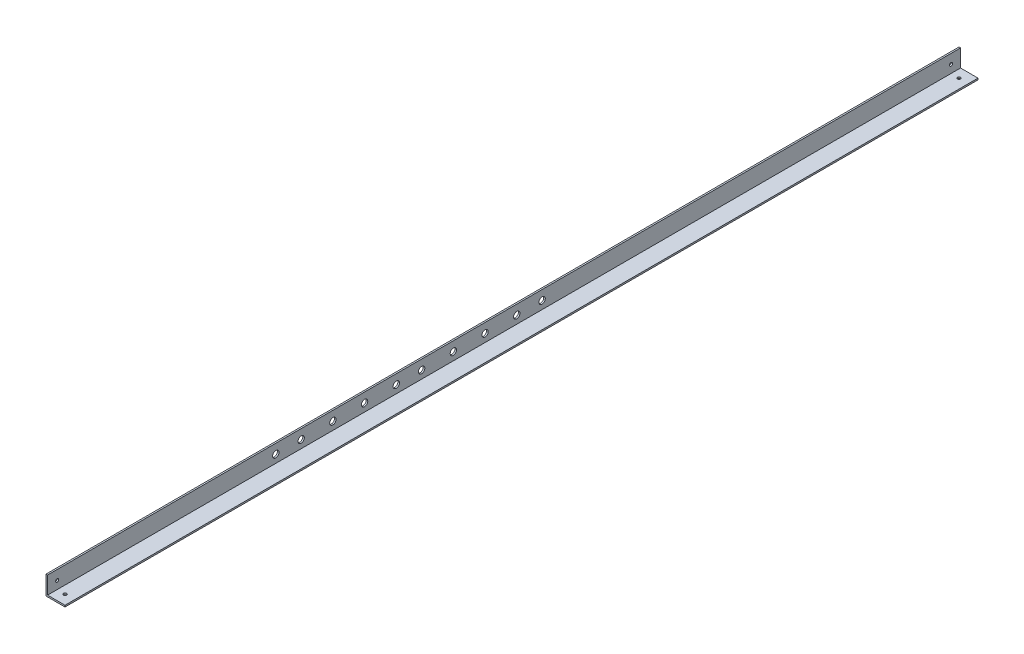
from build123d import *

# Parameters (mm, degrees)
BOSS_EXTRUDE1_DEPTH = 914.4
SKETCH2_R           = 1.5875
CUT_EXTRUDE2_DEPTH  = 2.794
SKETCH4_R           = 1.5875
SKETCH4_R_2         = 3.175
CUT_EXTRUDE3_DEPTH  = 8.89
SKETCH10_W          = 19.05
SKETCH10_H          = 914.4
CUT_EXTRUDE4_DEPTH  = 915.79678891
CUT_EXTRUDE5_REACH  = 916.797
SKETCH11_R          = 3.175


with BuildPart() as part:
    # Sketch1 → Boss-Extrude1 (new body)
    with BuildSketch(Plane.XY):
        Polygon((0, 0), (0, 19.05), (1.5875, 19.05), (1.5875, 1.5875), (19.05, 1.5875), (19.05, 0), align=None)
    boss_extrude1 = extrude(amount=-BOSS_EXTRUDE1_DEPTH)

    # Sketch2 → Cut-Extrude2 (cut)
    with BuildSketch(Plane(origin=(0, 1.5875, 0), x_dir=(1, 0, 0), z_dir=(0, 1, 0))):
        with Locations((9.525, 9.525)):
            Circle(SKETCH2_R)
        with Locations((9.525, 904.875)):
            Circle(SKETCH2_R)
    cut_extrude2 = extrude(amount=-CUT_EXTRUDE2_DEPTH, mode=Mode.SUBTRACT)

    # Sketch4 → Cut-Extrude3 (cut)
    with BuildSketch(Plane(origin=(1.5875, 0, 0), x_dir=(0, 0, -1), z_dir=(1, 0, 0))):
        with Locations((9.525, 9.525)):
            Circle(SKETCH4_R)
        with Locations((904.875, 9.525)):
            Circle(SKETCH4_R)
        with Locations((254, 9.525)):
            Circle(SKETCH4_R_2)
        with Locations((285.75, 9.525)):
            Circle(SKETCH4_R_2)
        with Locations((317.5, 9.525)):
            Circle(SKETCH4_R_2)
        with Locations((349.25, 9.525)):
            Circle(SKETCH4_R_2)
        with Locations((469.9, 9.525)):
            Circle(SKETCH4_R_2)
        with Locations((406.4, 9.525)):
            Circle(SKETCH4_R_2)
        with Locations((438.15, 9.525)):
            Circle(SKETCH4_R_2)
        with Locations((374.65, 9.525)):
            Circle(SKETCH4_R_2)
    cut_extrude3 = extrude(amount=-CUT_EXTRUDE3_DEPTH, mode=Mode.SUBTRACT)

    # Mirror1: Boss-Extrude1, Cut-Extrude2, Cut-Extrude3 across plane
    add(boss_extrude1.mirror(Plane(origin=(0, 19.05, -914.4), x_dir=(0, 0, 1), z_dir=(0, 1, 0))))
    add(cut_extrude2.mirror(Plane(origin=(0, 19.05, -914.4), x_dir=(0, 0, 1), z_dir=(0, 1, 0))), mode=Mode.SUBTRACT)
    add(cut_extrude3.mirror(Plane(origin=(0, 19.05, -914.4), x_dir=(0, 0, 1), z_dir=(0, 1, 0))), mode=Mode.SUBTRACT)

    # Sketch10 → Cut-Extrude4 (cut, through all)
    with BuildSketch(Plane(origin=(0, 19.05, 0), x_dir=(-1, 0, 0), z_dir=(0, -1, 0))):
        with Locations((-9.525, 457.2)):
            Rectangle(SKETCH10_W, SKETCH10_H)
    extrude(amount=-CUT_EXTRUDE4_DEPTH, mode=Mode.SUBTRACT)

    # Sketch11 → Cut-Extrude5 (cut, up to next)
    with BuildSketch(Plane.ZY, mode=Mode.PRIVATE) as cut_extrude5_sk1:
        with Locations((-228.6, 9.525)):
            Circle(SKETCH11_R)
    cut_extrude5_tool1 = extrude(cut_extrude5_sk1.sketch, amount=-CUT_EXTRUDE5_REACH, mode=Mode.PRIVATE) & part.part
    # Sketch11 → Cut-Extrude5 (cut, up to next)
    with BuildSketch(Plane.ZY, mode=Mode.PRIVATE) as cut_extrude5_sk2:
        with Locations((-495.3, 9.525)):
            Circle(SKETCH11_R)
    cut_extrude5_tool2 = extrude(cut_extrude5_sk2.sketch, amount=-CUT_EXTRUDE5_REACH, mode=Mode.PRIVATE) & part.part
    add(cut_extrude5_tool1.solids().sort_by_distance((0, 9.525, -228.6))[0], mode=Mode.SUBTRACT)
    add(cut_extrude5_tool2.solids().sort_by_distance((0, 9.525, -495.3))[0], mode=Mode.SUBTRACT)


solid = part.part
